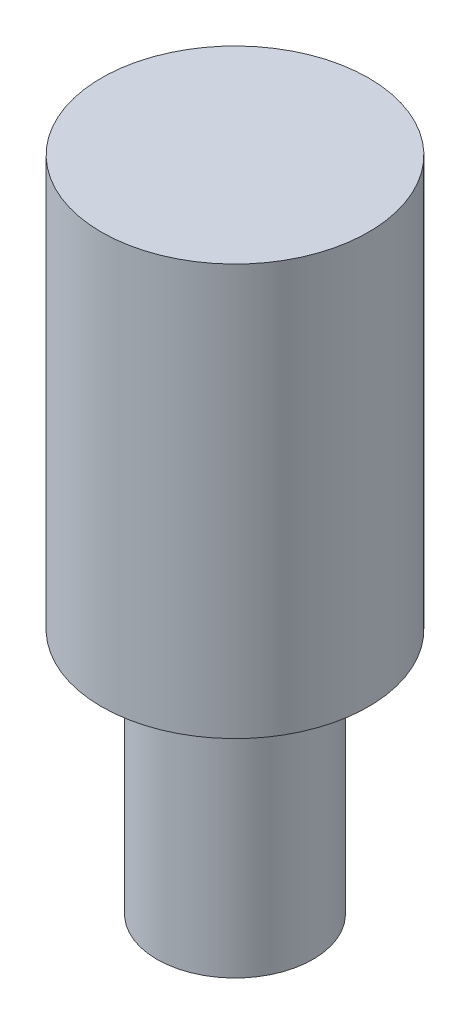
from build123d import *

# Parameters (mm, degrees)
SKETCH_1_R      = 1.9
EXTRUDE_1_DEPTH = 6
SKETCH_2_R      = 3.25
EXTRUDE_2_DEPTH = 10


with BuildPart() as part:
    # 草图1 → 凸台-拉伸1 (new body)
    with BuildSketch(Plane(origin=(0, 0, 0), x_dir=(1, 0, 0), z_dir=(0, 1, 0))):
        with Locations(Location((0, 0, 0), (0, 0, 270))):
            Circle(SKETCH_1_R)
    extrude(amount=EXTRUDE_1_DEPTH)

    # 草图2 → 凸台-拉伸2 (add)
    with BuildSketch(Plane(origin=(0, 6, 0), x_dir=(1, 0, 0), z_dir=(0, 1, 0))):
        with Locations(Location((0, 0, 0), (0, 0, 270))):
            Circle(SKETCH_2_R)
    extrude(amount=EXTRUDE_2_DEPTH)


solid = part.part
